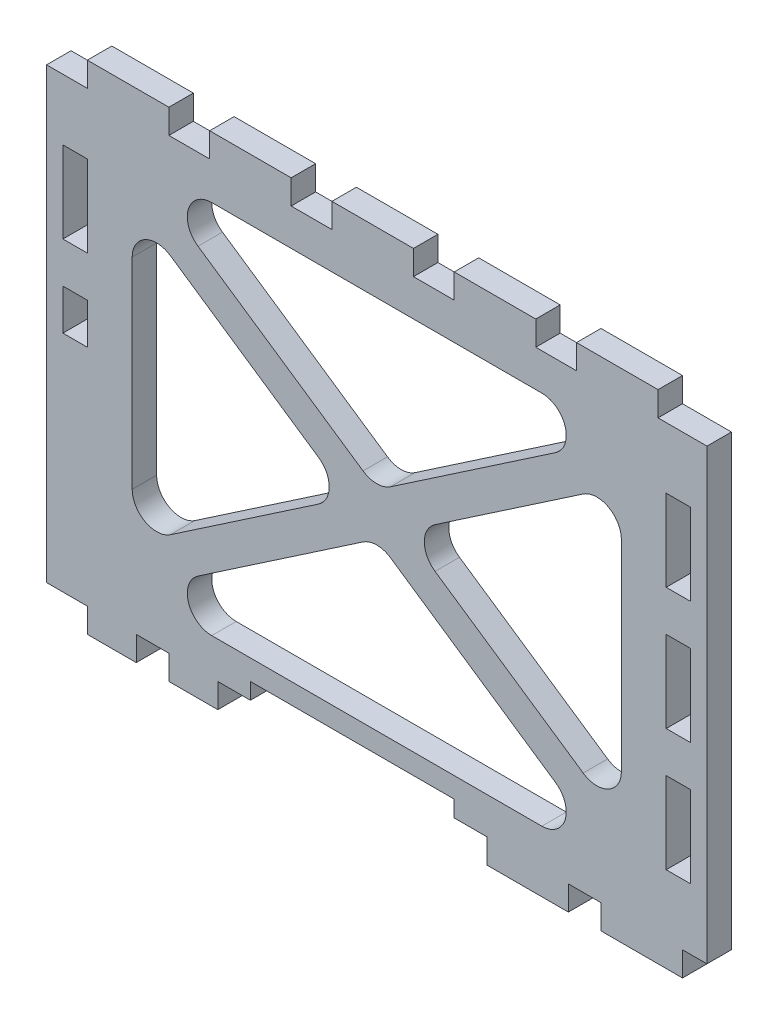
from build123d import *

# Parameters (mm, degrees)
SKETCH_1_W          = 3
SKETCH_1_H          = 10
SKETCH_1_H_2        = 5
EXTRUDE_1_DEPTH     = 3
CUT_EXTRUDE_1_DEPTH = 10
FILLET_1_R          = 3


with BuildPart() as part:
    # 草图1 → 凸台-拉伸1 (new body)
    with BuildSketch(Plane.XY):
        Polygon((-10.5, 27.5), (-10.5, 30.5), (-20.5, 30.5), (-20.5, 27.5), (-25.5, 27.5), (-25.5, 30.5), (-35.5, 30.5), (-35.5, 27.5), (-40.5, 27.5), (-40.5, -27.5), (-35.5, -27.5), (-35.5, -30.5), (-29.5, -30.5), (-29.5, -27.5), (-25.5, -27.5), (-25.5, -30.5), (-19.5, -30.5), (-19.5, -27.5), (-15.5, -27.5), (-15.5, -25.5), (9.5, -25.5), (9.5, -27.5), (13.5, -27.5), (13.5, -30.5), (23.5, -30.5), (23.5, -27.5), (27.5, -27.5), (27.5, -30.5), (37.5, -30.5), (37.5, -27.5), (40.5, -27.5), (40.5, 27.5), (34.5, 27.5), (34.5, 30.5), (24.5, 30.5), (24.5, 27.5), (19.5, 27.5), (19.5, 30.5), (9.5, 30.5), (9.5, 27.5), (4.5, 27.5), (4.5, 30.5), (-5.5, 30.5), (-5.5, 27.5), align=None)
        with Locations((37, 0)):
            Rectangle(SKETCH_1_W, SKETCH_1_H, mode=Mode.SUBTRACT)
        with Locations((37, 15)):
            Rectangle(SKETCH_1_W, SKETCH_1_H, mode=Mode.SUBTRACT)
        with Locations((37, -15)):
            Rectangle(SKETCH_1_W, SKETCH_1_H, mode=Mode.SUBTRACT)
        with Locations((-37, 2.5)):
            Rectangle(SKETCH_1_W, SKETCH_1_H_2, mode=Mode.SUBTRACT)
        with Locations((-37, 15)):
            Rectangle(SKETCH_1_W, SKETCH_1_H, mode=Mode.SUBTRACT)
    extrude(amount=EXTRUDE_1_DEPTH)

    # 草图2 → 切除-拉伸1 (cut)
    with BuildSketch(Plane.XY.offset(3)):
        Polygon((-30, 23), (30, 23), (0, 2.62962963), align=None)
        Polygon((-30, -23), (0, -2.62962963), (30, -23), align=None)
        Polygon((30, -18), (30, 18), (3.490909091, 0), align=None)
        Polygon((-30, -18), (-3.490909091, 0), (-30, 18), align=None)
    extrude(amount=-CUT_EXTRUDE_1_DEPTH, mode=Mode.SUBTRACT)

    # 圆角1
    fillet_1_edges = [part.edges().sort_by_distance(p)[0] for p in [
        (30, -18, 1.5),
        (3.490909091, 0, 1.5),
        (30, 18, 1.5),
        (30, -23, 1.5),
        (-30, -23, 1.5),
        (0, -2.62962963, 1.5),
        (-30, -18, 1.5),
        (-30, 18, 1.5),
        (-3.490909091, 0, 1.5),
        (30, 23, 1.5),
        (0, 2.62962963, 1.5),
        (-30, 23, 1.5),
    ]]
    fillet(fillet_1_edges, radius=FILLET_1_R)


solid = part.part
